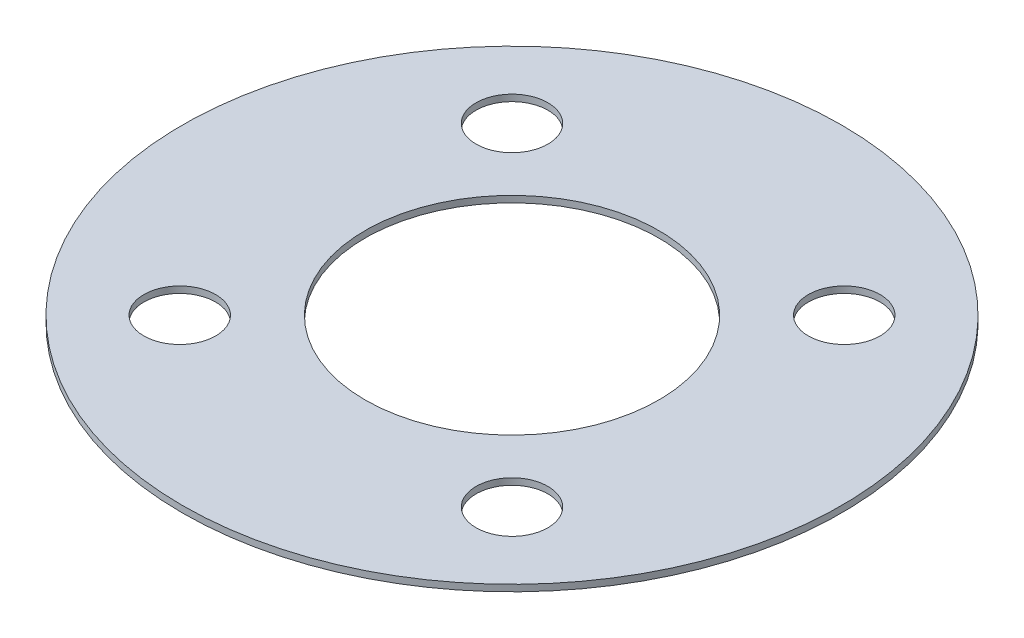
from build123d import *

# Parameters (mm, degrees)
SKETCH_1_R          = 25.25
EXTRUDE_1_DEPTH     = 0.5
SKETCH_2_R          = 11.25
CUT_EXTRUDE_1_DEPTH = 36.712392807
HOLE_WIZARD_M5_1_D  = 5.5


with BuildPart() as part:
    # ｽｹｯﾁ1 → ﾎﾞｽ - 押し出し1 (new body)
    with BuildSketch(Plane(origin=(0, 0, 0), x_dir=(1, 0, 0), z_dir=(0, 1, 0))):
        with Locations(Location((0, 0, 0), (0, 0, 270))):
            Circle(SKETCH_1_R)
    extrude(amount=EXTRUDE_1_DEPTH)

    # ｽｹｯﾁ2 → ｶｯﾄ - 押し出し1 (cut, through all)
    with BuildSketch(Plane(origin=(0, 0.5, 0), x_dir=(1, 0, 0), z_dir=(0, 1, 0))):
        with Locations(Location((0, 0, 0), (0, 0, 270))):
            Circle(SKETCH_2_R)
    extrude(amount=-CUT_EXTRUDE_1_DEPTH, mode=Mode.SUBTRACT)

    # M5 すきま穴1 (through all)
    with Locations(Plane(origin=(0, 0.5, 0), x_dir=(1, 0, 0), z_dir=(0, 1, 0))):
        with Locations((-12.727922061, 12.727922061), (12.727922061, -12.727922061), (-12.727922061, -12.727922061), (12.727922061, 12.727922061)):
            Hole(HOLE_WIZARD_M5_1_D / 2)


solid = part.part
